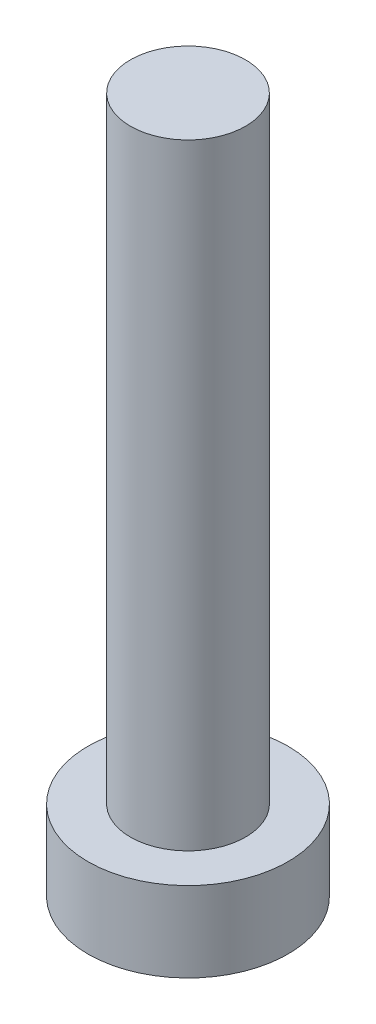
from build123d import *

# Parameters (mm, degrees)
SKETCH1_R           = 4.1275
BOSS_EXTRUDE1_DEPTH = 3.302
SKETCH2_R           = 2.3749
BOSS_EXTRUDE2_DEPTH = 25.4


with BuildPart() as part:
    # Sketch1 → Boss-Extrude1 (new body)
    with BuildSketch(Plane(origin=(0, 0, 0), x_dir=(1, 0, 0), z_dir=(0, 1, 0))):
        with Locations(Location((0, 0, 0), (0, 0, 90))):
            Circle(SKETCH1_R)
    extrude(amount=BOSS_EXTRUDE1_DEPTH)

    # Sketch2 → Boss-Extrude2 (add)
    with BuildSketch(Plane(origin=(0, 3.302, 0), x_dir=(1, 0, 0), z_dir=(0, 1, 0))):
        with Locations(Location((0, 0, 0), (0, 0, 270))):
            Circle(SKETCH2_R)
    extrude(amount=BOSS_EXTRUDE2_DEPTH)


solid = part.part
